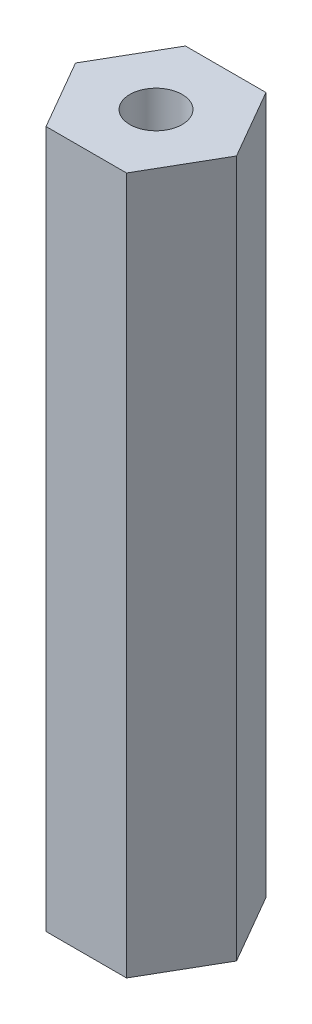
from build123d import *

# Parameters (mm, degrees)
BOSS_EXTRUDE1_DEPTH = 60
SKETCH3_R           = 2.25
CUT_EXTRUDE1_DEPTH  = 61.695963622


with BuildPart() as part:
    # Sketch2 → Boss-Extrude1 (new body)
    with BuildSketch(Plane(origin=(0, 0, 0), x_dir=(1, 0, 0), z_dir=(0, 1, 0))):
        Polygon((6.92820323, 0), (3.464101615, 6), (-3.464101615, 6), (-6.92820323, 0), (-3.464101615, -6), (3.464101615, -6), align=None)
    extrude(amount=BOSS_EXTRUDE1_DEPTH)

    # Sketch3 → Cut-Extrude1 (cut, through all)
    with BuildSketch(Plane(origin=(0, 0, 0), x_dir=(1, 0, 0), z_dir=(0, 1, 0))):
        with Locations(Location((0, 0, 0), (0, 0, 270))):
            Circle(SKETCH3_R)
    extrude(amount=CUT_EXTRUDE1_DEPTH, mode=Mode.SUBTRACT)


solid = part.part
